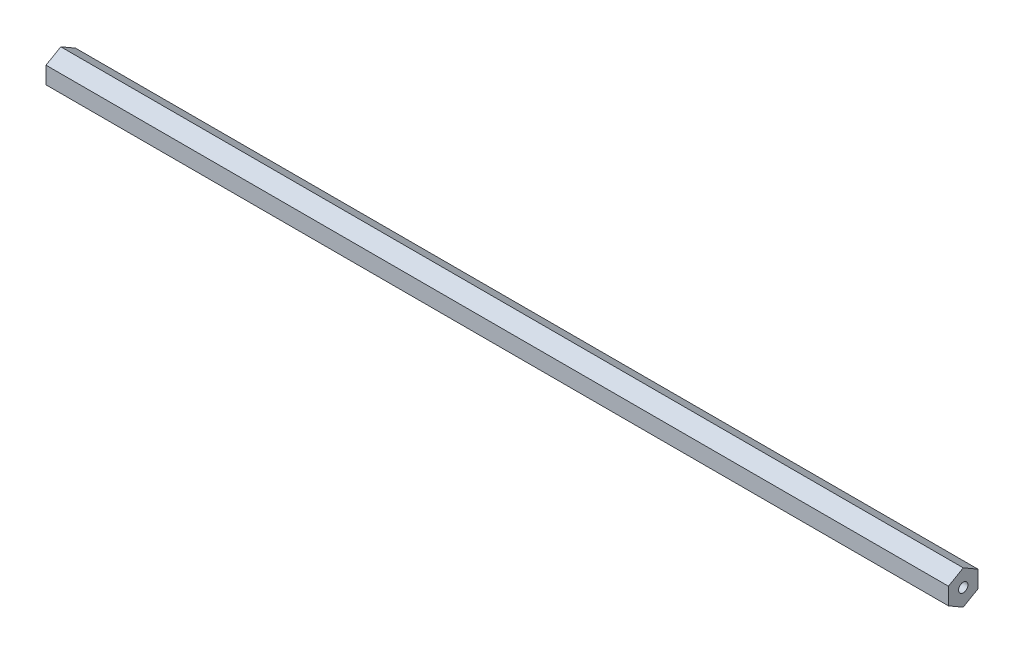
from build123d import *

# Parameters (mm, degrees)
BOSS_EXTRUDE1_DEPTH                  = 194.071875
F_10_32_TAPPED_HOLE2_D               = 4.0386
F_10_32_TAPPED_HOLE2_DEPTH           = 16.34744
F_10_32_TAPPED_HOLE2_TIP             = 1.213317848
F_10_32_TAPPED_HOLE2_ON_FACE_2_D     = 4.0386
F_10_32_TAPPED_HOLE2_ON_FACE_2_DEPTH = 16.34744
F_10_32_TAPPED_HOLE2_ON_FACE_2_TIP   = 1.213317848


with BuildPart() as part:
    # Sketch1 → Boss-Extrude1 (new, symmetric)
    with BuildSketch(Plane(origin=(0, 0, 0), x_dir=(0, 0, -1), z_dir=(1, 0, 0))):
        Polygon((0, 7.332348419), (-6.35, 3.666174209), (-6.35, -3.666174209), (0, -7.332348419), (6.35, -3.666174209), (6.35, 3.666174209), align=None)
    extrude(amount=BOSS_EXTRUDE1_DEPTH, both=True)

    # #10-32 Tapped Hole2
    with Locations(Plane(origin=(194.071875, 0, 0), x_dir=(0, 0, 1), z_dir=(1, 0, 0))):
        with Locations((0, 0)):
            Hole(F_10_32_TAPPED_HOLE2_D / 2, depth=F_10_32_TAPPED_HOLE2_DEPTH)
            with Locations((0, 0, -(F_10_32_TAPPED_HOLE2_DEPTH + F_10_32_TAPPED_HOLE2_TIP / 2))):  # 118° drill point
                Cone(0, F_10_32_TAPPED_HOLE2_D / 2, F_10_32_TAPPED_HOLE2_TIP, mode=Mode.SUBTRACT)

    # #10-32 Tapped Hole2 on face 2
    with Locations(Plane(origin=(-194.071875, 0, 0), x_dir=(0, 0, -1), z_dir=(-1, 0, 0))):
        with Locations((0, 0)):
            Hole(F_10_32_TAPPED_HOLE2_ON_FACE_2_D / 2, depth=F_10_32_TAPPED_HOLE2_ON_FACE_2_DEPTH)
            with Locations((0, 0, -(F_10_32_TAPPED_HOLE2_ON_FACE_2_DEPTH + F_10_32_TAPPED_HOLE2_ON_FACE_2_TIP / 2))):  # 118° drill point
                Cone(0, F_10_32_TAPPED_HOLE2_ON_FACE_2_D / 2, F_10_32_TAPPED_HOLE2_ON_FACE_2_TIP, mode=Mode.SUBTRACT)


solid = part.part
